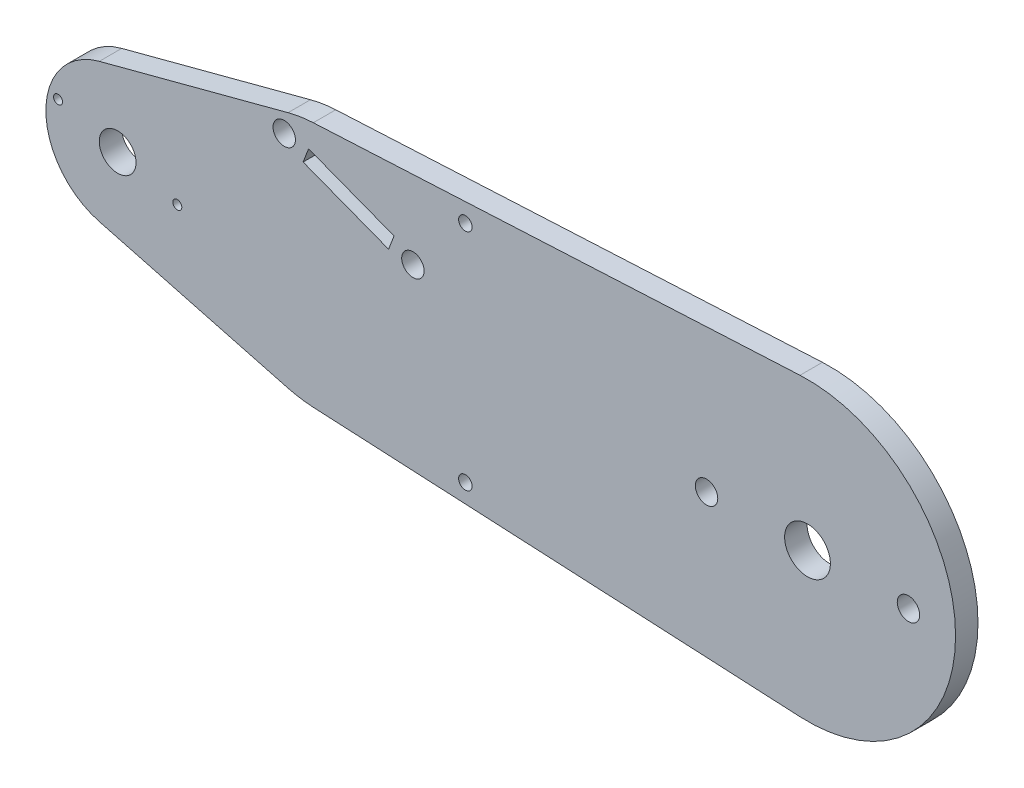
from build123d import *

# Parameters (mm, degrees)
SKETCH1_R           = 16
SKETCH1_R_2         = 4.1
SKETCH1_R_3         = 5.1
BOSS_EXTRUDE1_DEPTH = 5
SKETCH7_R           = 2.5
CUT_EXTRUDE1_DEPTH  = 7
BOSS_EXTRUDE6_DEPTH = 8
SKETCH9_R           = 1.5
CUT_EXTRUDE2_DEPTH  = 6
SKETCH10_R          = 2.5
BOSS_EXTRUDE7_DEPTH = 5
CUT_EXTRUDE4_START  = -10
SKETCH12_R          = 2.5
CUT_EXTRUDE4_DEPTH  = 10
SKETCH11_R          = 1
CUT_EXTRUDE3_DEPTH  = 6
CUT_EXTRUDE5_START  = 5
CUT_EXTRUDE5_DEPTH  = 5


with BuildPart() as part:
    # Sketch1 → Boss-Extrude1 (new body)
    # profile 1 of 3: a face of its own
    with BuildSketch(Plane.XY):
        with BuildLine():
            ThreePointArc((-63.902777778, -26.586845234), (-84.375, 0), (-63.902777778, 26.586845234))
            Line((-63.902777778, 26.586845234), (-105.963888889, 15.468709954))
            ThreePointArc((-105.963888889, 15.468709954), (-92.113397217, 12.677188612), (-85.875, 0))
            ThreePointArc((-85.875, 0), (-92.113397217, -12.677188612), (-105.963888889, -15.468709954))
            Line((-105.963888889, -15.468709954), (-63.902777778, -26.586845234))
        make_face()
    # profile 2 of 3: a face of its own
    with BuildSketch(Plane.XY):
        with Locations((-101.875, 0)):
            Circle(SKETCH1_R)
        with Locations((-101.875, 0)):
            Circle(SKETCH1_R_2, mode=Mode.SUBTRACT)
    # profile 3 of 3: a face of its own
    with BuildSketch(Plane.XY):
        with BuildLine():
            Line((-58.265804598, 27.46480771), (50.206034483, 32.957769253))
            ThreePointArc((50.206034483, 32.957769253), (84.875, 0), (50.206034483, -32.957769253))
            Line((50.206034483, -32.957769253), (-58.265804598, -27.46480771))
            ThreePointArc((-58.265804598, -27.46480771), (-84.375, 0), (-58.265804598, 27.46480771))
        make_face()
        with Locations((51.875, 0)):
            Circle(SKETCH1_R_3, mode=Mode.SUBTRACT)
    extrude(amount=BOSS_EXTRUDE1_DEPTH)

    # Sketch7 → Cut-Extrude1 (cut)
    with BuildSketch(Plane.XY.offset(5)):
        with Locations((29.375, 0)):
            Circle(SKETCH7_R)
        with Locations((74.375, 0)):
            Circle(SKETCH7_R)
    extrude(amount=-CUT_EXTRUDE1_DEPTH, mode=Mode.SUBTRACT)

    # Sketch8 → Boss-Extrude6 (add)
    with BuildSketch(Plane.XY.offset(5)):
        Polygon((-26.375, 28.464101615), (-28.375, 25), (-26.375, 21.535898385), (-22.375, 21.535898385), (-20.375, 25), (-22.375, 28.464101615), align=None)
        Polygon((-25.991580754, 27.8), (-27.608161507, 25), (-25.991580754, 22.2), (-22.758419246, 22.2), (-21.141838493, 25), (-22.758419246, 27.8), align=None, mode=Mode.SUBTRACT)
    boss_extrude6 = extrude(amount=-BOSS_EXTRUDE6_DEPTH)

    # Sketch9 → Cut-Extrude2 (cut)
    with BuildSketch(Plane.XY.offset(5)):
        with Locations((-24.375, 25)):
            Circle(SKETCH9_R)
    cut_extrude2 = extrude(amount=-CUT_EXTRUDE2_DEPTH, mode=Mode.SUBTRACT)

    # Mirror1: Boss-Extrude6 across plane
    add(boss_extrude6.mirror(Plane.ZX))

    # Mirror2: Cut-Extrude2 across plane
    add(cut_extrude2.mirror(Plane.ZX), mode=Mode.SUBTRACT)

    # Sketch10 → Boss-Extrude7 (add)
    with BuildSketch(Plane.XY.offset(5)):
        with Locations((-36.06831441, 11.178241177)):
            Circle(SKETCH10_R)
        with Locations(Location((-64.742423683, 22.173717984, 0), (0, 0, 180))):
            Circle(SKETCH10_R)
        Polygon((-41.60537748, 11.695000918), (-60.279486753, 18.855841852), (-59.205360613, 21.656958243), (-40.53125134, 14.496117309), align=None)
    extrude(amount=BOSS_EXTRUDE7_DEPTH)

    # Sketch12 → Cut-Extrude4 (cut)
    with BuildSketch(Plane.XY.offset(10).offset(CUT_EXTRUDE4_START)):
        with Locations((-36.06831441, 11.178241177)):
            Circle(SKETCH12_R)
        with Locations((-64.742423683, 22.173717984)):
            Circle(SKETCH12_R)
        Polygon((-59.320493296, 21.915307745), (-40.272901838, 14.611249993), (-41.490244797, 11.436651416), (-60.537836255, 18.740709168), align=None)
    extrude(amount=CUT_EXTRUDE4_DEPTH, mode=Mode.SUBTRACT)

    # Sketch11 → Cut-Extrude3 (cut)
    with BuildSketch(Plane.XY.offset(5)):
        with Locations((-88.581577383, -3.513888889)):
            Circle(SKETCH11_R)
        with Locations((-115.168422617, 3.513888889)):
            Circle(SKETCH11_R)
    extrude(amount=-CUT_EXTRUDE3_DEPTH, mode=Mode.SUBTRACT)

    # Sketch13 → Cut-Extrude5 (cut)
    with BuildSketch(Plane(origin=(0, 0, 0), x_dir=(-1, 0, 0), z_dir=(0, 0, -1)).offset(CUT_EXTRUDE5_START)):
        with BuildLine():
            Line((105.963888889, 15.468709954), (63.902777778, 26.586845234))
            ThreePointArc((63.902777778, 26.586845234), (61.107119662, 27.172397082), (58.265804598, 27.46480771))
            Line((58.265804598, 27.46480771), (-50.206034483, 32.957769253))
            ThreePointArc((-50.206034483, 32.957769253), (-84.875, 0), (-50.206034483, -32.957769253))
            Line((-50.206034483, -32.957769253), (58.265804598, -27.46480771))
            ThreePointArc((58.265804598, -27.46480771), (61.107119662, -27.172397082), (63.902777778, -26.586845234))
            Line((63.902777778, -26.586845234), (105.963888889, -15.468709954))
            ThreePointArc((105.963888889, -15.468709954), (117.875, 0), (105.963888889, 15.468709954))
        make_face()
    extrude(amount=-CUT_EXTRUDE5_DEPTH, mode=Mode.SUBTRACT)


solid = part.part
